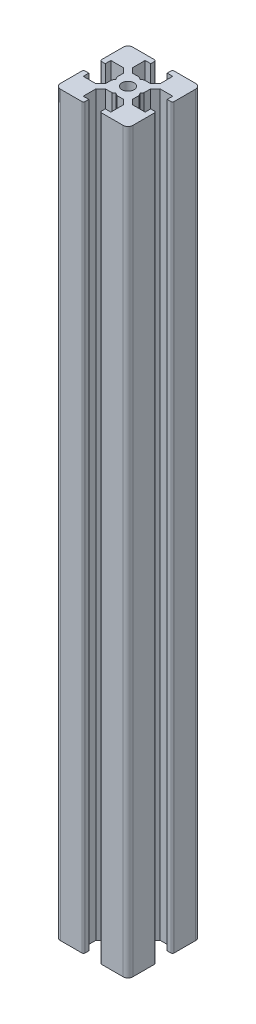
from build123d import *

# Parameters (mm, degrees)
SKETCH1_R           = 1.25
BOSS_EXTRUDE1_DEPTH = 152.4


with BuildPart() as part:
    # Sketch1 → Boss-Extrude1 (new body)
    with BuildSketch(Plane(origin=(0, 0, 0), x_dir=(1, 0, 0), z_dir=(0, 1, 0))):
        with BuildLine():
            Line((-7.055036042, 2.004660127), (-6.255036042, 2.004660127))
            Line((-6.255036042, 2.004660127), (-6.255036042, 3.154660127))
            Line((-6.255036042, 3.154660127), (-3.655036042, 3.154660127))
            Line((-3.655036042, 3.154660127), (-2.655036042, 2.154660127))
            Line((-2.655036042, 2.154660127), (-2.655036042, 0.82427537))
            Line((-2.655036042, 0.82427537), (-2.355036042, 0.304660127))
            Line((-2.355036042, 0.304660127), (-2.655036042, -0.214955115))
            Line((-2.655036042, -0.214955115), (-2.655036042, -1.545339873))
            Line((-2.655036042, -1.545339873), (-3.655036042, -2.545339873))
            Line((-3.655036042, -2.545339873), (-6.255036042, -2.545339873))
            Line((-6.255036042, -2.545339873), (-6.255036042, -1.395339873))
            Line((-6.255036042, -1.395339873), (-7.055036042, -1.395339873))
            ThreePointArc((-7.055036042, -1.395339873), (-7.267168077, -1.483207838), (-7.355036042, -1.695339873))
            Line((-7.355036042, -1.695339873), (-7.355036042, -6.195339873))
            ThreePointArc((-7.355036042, -6.195339873), (-7.062142824, -6.902446654), (-6.355036042, -7.195339873))
            Line((-6.355036042, -7.195339873), (-1.855036042, -7.195339873))
            ThreePointArc((-1.855036042, -7.195339873), (-1.642904008, -7.107471907), (-1.555036042, -6.895339873))
            Line((-1.555036042, -6.895339873), (-1.555036042, -6.095339873))
            Line((-1.555036042, -6.095339873), (-2.705036042, -6.095339873))
            Line((-2.705036042, -6.095339873), (-2.705036042, -3.495339873))
            Line((-2.705036042, -3.495339873), (-1.705036042, -2.495339873))
            Line((-1.705036042, -2.495339873), (-0.374651285, -2.495339873))
            Line((-0.374651285, -2.495339873), (0.144963958, -2.195339873))
            Line((0.144963958, -2.195339873), (0.6645792, -2.495339873))
            Line((0.6645792, -2.495339873), (1.994963958, -2.495339873))
            Line((1.994963958, -2.495339873), (2.994963958, -3.495339873))
            Line((2.994963958, -3.495339873), (2.994963958, -6.095339873))
            Line((2.994963958, -6.095339873), (1.844963958, -6.095339873))
            Line((1.844963958, -6.095339873), (1.844963958, -6.895339873))
            ThreePointArc((1.844963958, -6.895339873), (1.932831923, -7.107471907), (2.144963958, -7.195339873))
            Line((2.144963958, -7.195339873), (6.644963958, -7.195339873))
            ThreePointArc((6.644963958, -7.195339873), (7.352070739, -6.902446654), (7.644963958, -6.195339873))
            Line((7.644963958, -6.195339873), (7.644963958, -1.695339873))
            ThreePointArc((7.644963958, -1.695339873), (7.557095992, -1.483207838), (7.344963958, -1.395339873))
            Line((7.344963958, -1.395339873), (6.544963958, -1.395339873))
            Line((6.544963958, -1.395339873), (6.544963958, -2.545339873))
            Line((6.544963958, -2.545339873), (3.944963958, -2.545339873))
            Line((3.944963958, -2.545339873), (2.944963958, -1.545339873))
            Line((2.944963958, -1.545339873), (2.944963958, -0.214955115))
            Line((2.944963958, -0.214955115), (2.644963958, 0.304660127))
            Line((2.644963958, 0.304660127), (2.944963958, 0.82427537))
            Line((2.944963958, 0.82427537), (2.944963958, 2.154660127))
            Line((2.944963958, 2.154660127), (3.944963958, 3.154660127))
            Line((3.944963958, 3.154660127), (6.544963958, 3.154660127))
            Line((6.544963958, 3.154660127), (6.544963958, 2.004660127))
            Line((6.544963958, 2.004660127), (7.344963958, 2.004660127))
            ThreePointArc((7.344963958, 2.004660127), (7.557095992, 2.092528093), (7.644963958, 2.304660127))
            Line((7.644963958, 2.304660127), (7.644963958, 6.804660127))
            ThreePointArc((7.644963958, 6.804660127), (7.352070739, 7.511766909), (6.644963958, 7.804660127))
            Line((6.644963958, 7.804660127), (2.144963958, 7.804660127))
            ThreePointArc((2.144963958, 7.804660127), (1.932831923, 7.716792162), (1.844963958, 7.504660127))
            Line((1.844963958, 7.504660127), (1.844963958, 6.704660127))
            Line((1.844963958, 6.704660127), (2.994963958, 6.704660127))
            Line((2.994963958, 6.704660127), (2.994963958, 4.104660127))
            Line((2.994963958, 4.104660127), (1.994963958, 3.104660127))
            Line((1.994963958, 3.104660127), (0.6645792, 3.104660127))
            Line((0.6645792, 3.104660127), (0.144963958, 2.804660127))
            Line((0.144963958, 2.804660127), (-0.374651285, 3.104660127))
            Line((-0.374651285, 3.104660127), (-1.705036042, 3.104660127))
            Line((-1.705036042, 3.104660127), (-2.705036042, 4.104660127))
            Line((-2.705036042, 4.104660127), (-2.705036042, 6.704660127))
            Line((-2.705036042, 6.704660127), (-1.555036042, 6.704660127))
            Line((-1.555036042, 6.704660127), (-1.555036042, 7.504660127))
            ThreePointArc((-1.555036042, 7.504660127), (-1.642904008, 7.716792162), (-1.855036042, 7.804660127))
            Line((-1.855036042, 7.804660127), (-6.355036042, 7.804660127))
            ThreePointArc((-6.355036042, 7.804660127), (-7.062142824, 7.511766909), (-7.355036042, 6.804660127))
            Line((-7.355036042, 6.804660127), (-7.355036042, 2.304660127))
            ThreePointArc((-7.355036042, 2.304660127), (-7.267168077, 2.092528093), (-7.055036042, 2.004660127))
        make_face()
        with Locations(Location((0.144963958, 0.304660127, 0), (0, 0, 90))):
            Circle(SKETCH1_R, mode=Mode.SUBTRACT)
    extrude(amount=BOSS_EXTRUDE1_DEPTH)


solid = part.part
